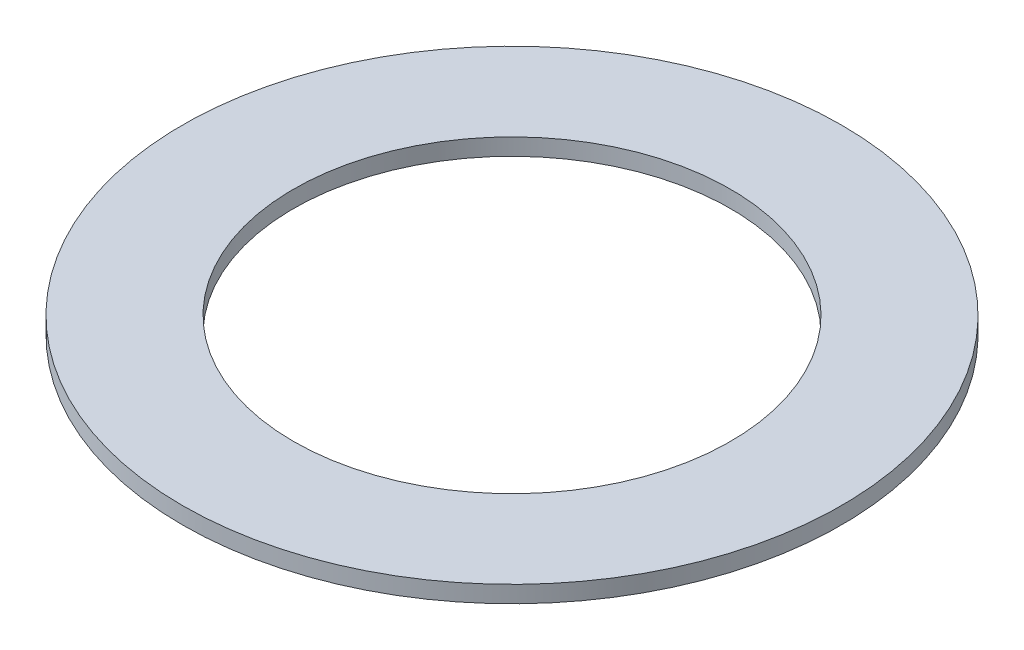
from build123d import *

# Parameters (mm, degrees)
BOSS_EXTRUDE1_DEPTH      = 2
BOSS_EXTRUDE1_DEPTH_BACK = 2
SKETCH1_R                = 78.35
SKETCH1_R_2              = 51.95


with BuildPart() as part:
    # Sketch1 → Boss-Extrude1 (new, two sides: drawn at the far end of the back side and taken through both)
    with BuildSketch(Plane(origin=(0, 0, 0), x_dir=(1, 0, 0), z_dir=(0, 1, 0)).offset(-BOSS_EXTRUDE1_DEPTH_BACK)):
        Circle(SKETCH1_R)
        Circle(SKETCH1_R_2, mode=Mode.SUBTRACT)
    extrude(amount=BOSS_EXTRUDE1_DEPTH + BOSS_EXTRUDE1_DEPTH_BACK)


solid = part.part
